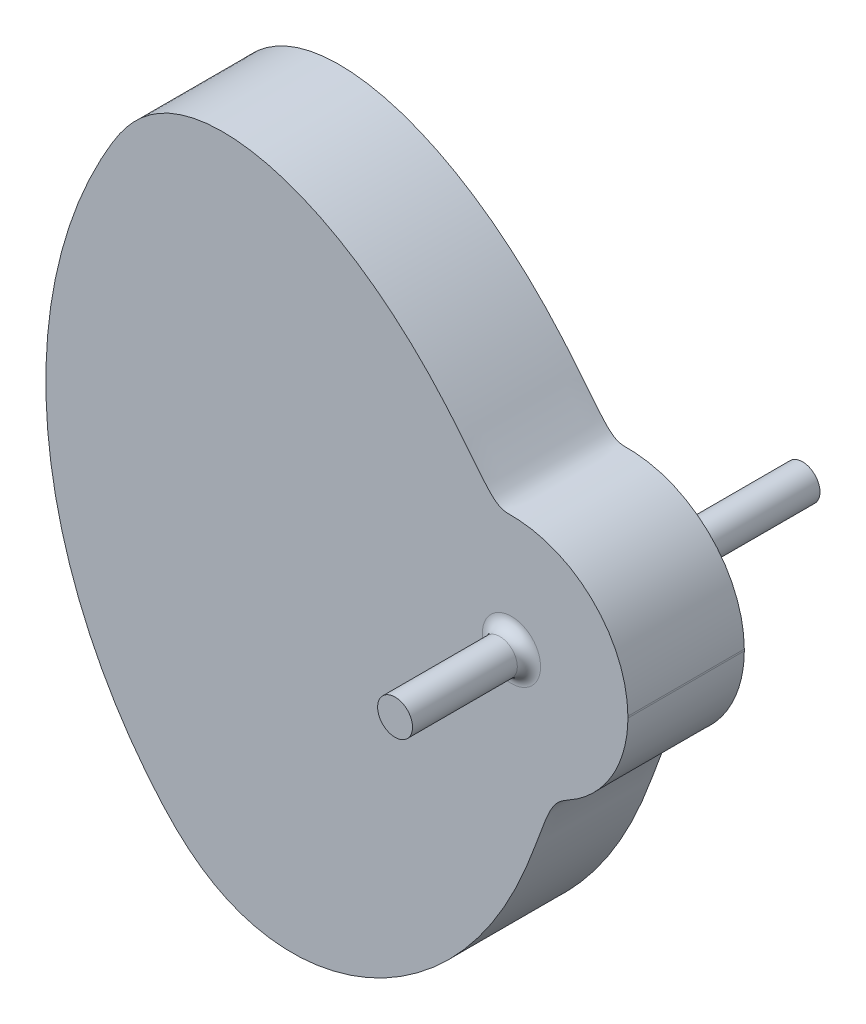
from build123d import *

# Parameters (mm, degrees)
BOSS_EXTRUDE1_DEPTH      = 25.4
BOSS_EXTRUDE2_DEPTH      = 25.4
BOSS_EXTRUDE2_DEPTH_BACK = 63.5
SKETCH2_R                = 3.81
SKETCH3_R                = 8.89
BOSS_EXTRUDE3_DEPTH      = 12.7
FILLET1_R                = 2.54
FILLET2_R                = 2.54
FILLET3_R                = 2.54


with BuildPart() as part:
    # Sketch1 → Boss-Extrude1 (new body)
    with BuildSketch(Plane.XY):
        with BuildLine():
            Line((25.399342089, 0.171082451), (25.399342089, -0.182816221))
            add(Edge.make_bspline(
                [(25.399342089, 0.171082451), (25.399182809, 0.198720573), (25.398379058, 0.311022212), (25.395313045, 0.507974599), (25.389002148, 0.761898402), (25.374171141, 1.184977755), (25.322987895, 2.115007416), (25.189788752, 3.378786707), (24.939391586, 4.882557766), (24.625145682, 6.28783201), (24.203789823, 7.75313954), (23.695326898, 9.190544355), (23.10158621, 10.594873055), (22.424704749, 11.96107165), (21.667118633, 13.284223335), (20.8315542, 14.559566107), (19.971604117, 15.714568922), (19.103823266, 16.755350159), (18.185110807, 17.751460759), (17.152132188, 18.75470584), (15.996660158, 19.749467936), (14.783617596, 20.673153386), (13.517369959, 21.522437818), (12.202474363, 22.29426464), (10.843663087, 22.985856286), (9.445826317, 23.594723662), (8.01399474, 24.118675402), (6.553321529, 24.555826254), (5.151522116, 24.885225825), (3.733929235, 25.13703166), (2.304441584, 25.310555052), (1.12076568, 25.382606447), (0.352151463, 25.398592348), (0.006739845, 25.400453922), (-0.254022616, 25.399159402), (-0.50818232, 25.39924592), (-0.762752478, 25.404330265), (-1.018117329, 25.417854394), (-1.274762502, 25.443052502), (-1.533256302, 25.482946367), (-1.794236222, 25.54033291), (-2.058404138, 25.617768751), (-2.326531794, 25.717559623), (-2.599471378, 25.841761094), (-2.878162638, 25.992191445), (-3.163630427, 26.170450919), (-3.456972847, 26.377939718), (-3.759344221, 26.61587039), (-4.071937622, 26.885274371), (-4.395969427, 27.187004967), (-4.732667282, 27.521738237), (-5.083259981, 27.889974596), (-5.448969679, 28.292040517), (-5.831004623, 28.728091792), (-6.230553168, 29.198116984), (-6.648777392, 29.701942324), (-7.086807828, 30.239236313), (-7.545737465, 30.809515602), (-8.026616899, 31.412150279), (-8.530448824, 32.046370168), (-9.058183531, 32.71127061), (-9.610713906, 33.405819034), (-10.188871276, 34.12886113), (-10.793421291, 34.879127334), (-11.425059997, 35.655239444), (-12.084410439, 36.455717141), (-12.772019348, 37.278984747), (-13.48835417, 38.123377948), (-14.233800566, 38.987150453), (-15.008659976, 39.868480899), (-15.8131477, 40.765479561), (-16.647391095, 41.676195268), (-17.511428311, 42.598622088), (-18.405207031, 43.530706291), (-19.647619539, 44.795009988), (-21.272119088, 46.385450309), (-23.318591247, 48.281544641), (-25.105802893, 49.842219083), (-26.969137219, 51.394150136), (-28.510388349, 52.615656853), (-30.093488435, 53.805869756), (-31.307040444, 54.685342189), (-32.541487889, 55.546433537), (-33.795567611, 56.387105734), (-35.06794546, 57.20536717), (-36.357219693, 57.999278143), (-37.661924848, 58.766955936), (-38.980535582, 59.506580045), (-40.311471134, 60.216396756), (-41.653099665, 60.894724013), (-43.003743067, 61.539955709), (-44.361681822, 62.15056607), (-45.725160216, 62.725113505), (-47.092391679, 63.262244565), (-48.461564391, 63.760697264), (-49.830846927, 64.219304871), (-51.198394364, 64.636998364), (-52.562354211, 65.012809877), (-53.92087282, 65.3458748), (-55.272101733, 65.635434412), (-56.614204297, 65.880837733), (-57.945362368, 66.081543401), (-59.26378312, 66.237121214), (-60.567706008, 66.347253248), (-61.855409792, 66.41173499), (-63.125219711, 66.430475833), (-64.375514709, 66.403499791), (-65.604734773, 66.330945424), (-66.811388322, 66.213065928), (-67.994059739, 66.050228685), (-69.151416983, 65.842914903), (-70.282219278, 65.591718386), (-71.385324992, 65.297344814), (-72.459699565, 64.960610064), (-73.504423696, 64.582438748), (-74.518701467, 64.163861681), (-75.501868934, 63.70601406), (-76.453402387, 63.210131908), (-77.372927072, 62.677549125), (-78.260225746, 62.109693502), (-79.11524708, 61.508082102), (-79.938114383, 60.87431685), (-80.729133537, 60.210078529), (-81.488801358, 59.517121468), (-82.217813299, 58.797267011), (-82.917071057, 58.052397008), (-83.58768996, 57.284446858), (-84.231006159, 56.495398406), (-84.848583579, 55.687272451), (-85.442220756, 54.862121068), (-86.013957639, 54.022019736), (-86.566082247, 53.169058878), (-87.101137296, 52.305336232), (-87.573277087, 51.514440111), (-88.718247292, 49.54768194), (-90.292840679, 46.655774267), (-92.222487955, 42.697533327), (-93.856166163, 38.975463451), (-95.339693899, 35.1910418), (-96.67069868, 31.350321782), (-97.847050898, 27.459448008), (-98.866868797, 23.524644965), (-99.728520696, 19.552207488), (-100.430628315, 15.548490675), (-100.972068318, 11.519899578), (-101.351974512, 7.472879105), (-101.569739229, 3.413903617), (-101.625013963, -0.650533381), (-101.517710406, -4.713929668), (-101.24800027, -8.769784679), (-100.816314721, -12.811609895), (-100.223344704, -16.832939279), (-99.470038678, -20.82733955), (-98.557601691, -24.78842049), (-97.487493804, -28.709845299), (-96.261426591, -32.585340455), (-94.881361691, -36.408706026), (-93.349506671, -40.17382537), (-91.668312655, -43.874675286), (-89.840468608, -47.505334954), (-87.868899194, -51.05999633), (-85.756758133, -54.532972514), (-83.507424649, -57.918707637), (-81.323074346, -60.937361995), (-79.658750682, -63.075625178), (-78.592138132, -64.390837281), (-78.122883431, -64.957778934), (-77.650321468, -65.521947234), (-77.174448617, -66.083342603), (-76.508523154, -66.850682574), (-75.832560015, -67.609172507), (-75.145578888, -68.357655083), (-74.446692039, -69.094978116), (-73.735103725, -69.819996385), (-73.010107571, -70.531574604), (-72.271084613, -71.228590068), (-71.517501051, -71.909935302), (-70.748906072, -72.57452058), (-69.964929466, -73.221276238), (-69.165279543, -73.849155251), (-68.349740482, -74.457135057), (-67.518170334, -75.044220234), (-66.670498259, -75.609443984), (-65.806722328, -76.151870486), (-64.926906984, -76.670596606), (-64.03118045, -77.164753516), (-63.119732376, -77.633508639), (-62.192811135, -78.07606687), (-61.250721413, -78.491672378), (-60.293821483, -78.879609634), (-59.322520702, -79.239204866), (-58.337276847, -79.569827075), (-57.338593586, -79.87088922), (-56.327017782, -80.141849059), (-55.303136938, -80.38221002), (-54.267576561, -80.591521886), (-53.220997623, -80.769381647), (-52.164093917, -80.915433736), (-51.097589517, -81.02937063), (-50.022236274, -81.110933386), (-48.93881124, -81.159911601), (-47.848114193, -81.176143666), (-46.750965175, -81.15951711), (-45.648202055, -81.109968203), (-44.540678111, -81.02748225), (-43.429259671, -80.912093104), (-42.314823744, -80.763883159), (-41.198255729, -80.582983069), (-40.080447174, -80.369571009), (-38.962293508, -80.123872646), (-37.844691875, -79.846160311), (-36.728539011, -79.536752396), (-35.614729067, -79.196012911), (-34.504151657, -78.824350448), (-33.397689828, -78.422217418), (-32.296217998, -77.990109435), (-31.200600169, -77.528563981), (-30.111688057, -77.038159588), (-29.030319226, -76.519514798), (-27.957315363, -75.973287043), (-26.893480675, -75.400171198), (-25.839600109, -74.800898726), (-24.796437906, -74.176236085), (-23.764736021, -73.526983511), (-22.745212715, -72.853973583), (-21.402200392, -71.925541625), (-20.087493038, -70.953902452), (-18.481066979, -69.689087833), (-16.913788664, -68.37701667), (-15.098665416, -66.73394997), (-13.353007609, -65.030754584), (-11.679993226, -63.276030584), (-10.082231404, -61.47857518), (-8.561747269, -59.647323296), (-7.119971272, -57.791287391), (-5.757733891, -55.919496177), (-4.475265218, -54.040933106), (-3.272199781, -52.16447464), (-2.147586238, -50.298828855), (-1.099902179, -48.452474574), (-0.127074398, -46.633601035), (0.629808797, -45.134617771), (1.200666707, -43.955654688), (1.608219734, -43.090710371), (1.999360796, -42.238222084), (2.374575982, -41.399016435), (2.734376314, -40.573886163), (3.079296482, -39.763588611), (3.409893617, -38.968844317), (3.72674519, -38.190335266), (4.030447901, -37.428703695), (4.321615676, -36.684550542), (4.600877966, -35.958434167), (4.868878011, -35.250869038), (5.126270861, -34.562324531), (5.373721354, -33.893223655), (5.611902374, -33.243942089), (5.841492427, -32.614806956), (6.063173798, -32.006095983), (6.277630272, -31.418036506), (6.485544871, -30.8508046), (6.687597703, -30.304524354), (6.884463616, -29.779267165), (7.076809585, -29.275051034), (7.26529286, -28.791840235), (7.450558006, -28.329544681), (7.633234661, -27.888019692), (7.813935142, -27.467065823), (7.993251604, -27.066428657), (8.171753691, -26.685798976), (8.349985648, -26.324812816), (8.528463706, -25.983051885), (8.707672951, -25.660043848), (8.888064553, -25.355263048), (9.070052234, -25.068130891), (9.254008991, -24.798016453), (9.440263607, -24.544237003), (9.629096782, -24.306058016), (9.820737893, -24.082693446), (10.015361523, -23.873305392), (10.213084455, -23.67700372), (10.413963541, -23.492846206), (10.617993401, -23.319838343), (10.825104959, -23.15693432), (11.035163826, -23.003038297), (11.247968499, -22.857006225), (11.463248426, -22.717648389), (11.680661334, -22.583731585), (11.899790654, -22.453982057), (12.120142326, -22.327087556), (12.341141519, -22.201699772), (12.534607912, -22.092036672), (13.094808441, -21.770938964), (14.004578939, -21.208639665), (15.251131467, -20.330705921), (16.44279895, -19.379602316), (17.512372921, -18.415467286), (18.527189078, -17.394132773), (19.484458946, -16.318409941), (20.427914259, -15.12067896), (21.297851664, -13.868530468), (22.091139631, -12.566470034), (22.804923471, -11.219183978), (23.436634087, -9.831520892), (23.983998246, -8.408475005), (24.445045723, -6.955167628), (24.8181176, -5.476829221), (25.101871023, -3.978780121), (25.263049234, -2.718473118), (25.332570842, -1.874570004), (25.358885752, -1.452049974), (25.372135284, -1.198392727), (25.382860776, -0.944615733), (25.390999067, -0.690743925), (25.396780711, -0.436804358), (25.398488297, -0.267478931), (25.399342089, -0.182816221)],
                knots=[0.000402844, 0.000402844, 0.000402844, 0.000402844, 0.000598084, 0.001196167, 0.001794251, 0.002392334, 0.004186585, 0.008373169, 0.011363587, 0.014952088, 0.018540589, 0.02212909, 0.025717591, 0.029306093, 0.032894594, 0.036483095, 0.040071596, 0.043062014, 0.046052431, 0.049640932, 0.053229434, 0.056817935, 0.060406436, 0.063994937, 0.067583438, 0.071171939, 0.07476044, 0.078348942, 0.081937443, 0.08492786, 0.088516362, 0.092104863, 0.09330103, 0.09394674, 0.094544834, 0.09514308, 0.095742092, 0.096343276, 0.096949052, 0.097562987, 0.098189805, 0.098835274, 0.09950599, 0.100209074, 0.100951848, 0.101741542, 0.102585046, 0.103488752, 0.10445845, 0.105499289, 0.106615771, 0.107811768, 0.109090555, 0.110454844, 0.111906824, 0.113448198, 0.115080214, 0.116803698, 0.118619082, 0.120526431, 0.122525463, 0.124615575, 0.126795858, 0.129065121, 0.131421901, 0.133864484, 0.13639092, 0.138999034, 0.141686446, 0.144450576, 0.147288667, 0.150197789, 0.153174857, 0.15621664, 0.159319778, 0.165696075, 0.172274658, 0.179025079, 0.182454936, 0.189403981, 0.192915115, 0.196445276, 0.199990436, 0.203546591, 0.20710977, 0.210676048, 0.214241561, 0.217802512, 0.221355193, 0.22489599, 0.228421401, 0.231928044, 0.235412676, 0.238872203, 0.242303695, 0.245704396, 0.249071743, 0.252403377, 0.255697153, 0.25895116, 0.262163729, 0.265333446, 0.268459163, 0.271540013, 0.274575413, 0.277565078, 0.280509021, 0.283407563, 0.286261328, 0.289071245, 0.291838539, 0.294564722, 0.297251577, 0.299901139, 0.302515669, 0.305097623, 0.307649617, 0.310174387, 0.312674745, 0.315153529, 0.31761356, 0.320057588, 0.322488247, 0.324908008, 0.32731914, 0.329723678, 0.332123391, 0.334519768, 0.336914007, 0.339307022, 0.341699453, 0.344091697, 0.346483947, 0.34887625, 0.350598146, 0.362559817, 0.372129153, 0.38169849, 0.391267826, 0.400837162, 0.410406499, 0.419975835, 0.429545171, 0.439114508, 0.448683844, 0.458253181, 0.467822517, 0.477391853, 0.48696119, 0.496530526, 0.506099862, 0.515669199, 0.525238535, 0.534807872, 0.544377208, 0.553946544, 0.563515881, 0.573085217, 0.582654554, 0.59222389, 0.601793226, 0.611362563, 0.620931899, 0.630501235, 0.637678238, 0.640070572, 0.642462906, 0.642876895, 0.645269226, 0.647661536, 0.650053788, 0.652445946, 0.654837984, 0.657229901, 0.659621732, 0.662013552, 0.664405491, 0.666797731, 0.669190512, 0.671584135, 0.67397896, 0.67637541, 0.678773961, 0.681175148, 0.683579553, 0.685987808, 0.688400583, 0.690818584, 0.693242544, 0.695673218, 0.698111375, 0.70055779, 0.703013239, 0.705478487, 0.707954286, 0.710441364, 0.712940421, 0.715452121, 0.717977085, 0.720515888, 0.723069052, 0.725637043, 0.728220265, 0.730819057, 0.733433692, 0.736064371, 0.738711224, 0.741374308, 0.744053603, 0.746749017, 0.749460379, 0.752187445, 0.754929896, 0.757687338, 0.760459304, 0.763245255, 0.766044584, 0.768856613, 0.771680599, 0.774515735, 0.77736115, 0.780215917, 0.783079047, 0.7859495, 0.788826183, 0.791707953, 0.797481951, 0.800371671, 0.806149994, 0.811917677, 0.817663333, 0.823375193, 0.829041192, 0.834649069, 0.840186453, 0.845640955, 0.851000262, 0.856252226, 0.861384958, 0.866386917, 0.871247006, 0.875954661, 0.878248197, 0.880499955, 0.882708811, 0.884873689, 0.88699357, 0.889067495, 0.891094563, 0.893073943, 0.89500487, 0.896886652, 0.898718676, 0.900500407, 0.902231396, 0.903911283, 0.905539804, 0.907116789, 0.908642178, 0.910116014, 0.91153846, 0.912909797, 0.914230434, 0.915500913, 0.916721919, 0.917894281, 0.919018987, 0.920097184, 0.921130188, 0.922119492, 0.923066765, 0.923973862, 0.924842817, 0.925675844, 0.926475328, 0.927243807, 0.927983953, 0.928698542, 0.929390413, 0.930062421, 0.930717391, 0.931358055, 0.931986998, 0.93260661, 0.933219037, 0.933826148, 0.934429516, 0.93503041, 0.935629802, 0.936228384, 0.936826604, 0.937424708, 0.937799314, 0.941387815, 0.944976316, 0.948564817, 0.952153318, 0.955143736, 0.958732237, 0.962320738, 0.965909239, 0.96949774, 0.973086241, 0.976674743, 0.980263244, 0.983851745, 0.987440246, 0.991028747, 0.994617248, 0.996411499, 0.997009582, 0.997607666, 0.998205749, 0.998803833, 0.999401917, 1, 1, 1, 1], degree=3))
        make_face()
    extrude(amount=BOSS_EXTRUDE1_DEPTH)

    # Sketch2 → Boss-Extrude2 (add, two sides: drawn at the far end of the back side and taken through both)
    with BuildSketch(Plane.XY.offset(25.4).offset(-BOSS_EXTRUDE2_DEPTH_BACK)):
        Circle(SKETCH2_R)
    extrude(amount=BOSS_EXTRUDE2_DEPTH + BOSS_EXTRUDE2_DEPTH_BACK)

    # Sketch3 → Boss-Extrude3 (add)
    with BuildSketch(Plane(origin=(0, 0, 0), x_dir=(-1, 0, 0), z_dir=(0, 0, -1))):
        Circle(SKETCH3_R)
    extrude(amount=BOSS_EXTRUDE3_DEPTH)

    # Fillet1
    fillet1_edges = [part.edges().sort_by_distance(p)[0] for p in [
        (8.89, 0, 0),
    ]]
    fillet(fillet1_edges, radius=FILLET1_R)

    # Fillet2
    fillet2_edges = [part.edges().sort_by_distance(p)[0] for p in [
        (8.89, 0, -12.7),
    ]]
    fillet(fillet2_edges, radius=FILLET2_R)

    # Fillet3
    fillet3_edges = [part.edges().sort_by_distance(p)[0] for p in [
        (-3.81, 0, 25.4),
    ]]
    fillet(fillet3_edges, radius=FILLET3_R)


solid = part.part
